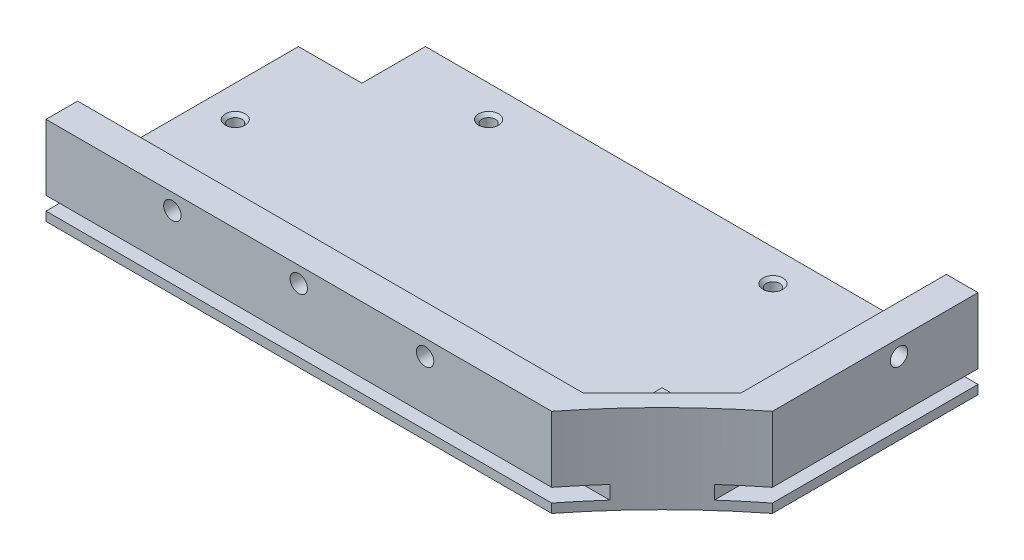
from build123d import *

# Parameters (mm, degrees)
SKETCH1_W                = 650
SKETCH1_H                = 650
BOSS_EXTRUDE1_DEPTH      = 8
BOSS_EXTRUDE2_DEPTH      = 650
CUT_EXTRUDE2_DEPTH       = 921.277302922
CUT_EXTRUDE2_DEPTH_BACK  = 921.277302922
SKETCH4_R                = 11
CUT_EXTRUDE1_DEPTH       = 920.932062709
CUT_EXTRUDE1_DEPTH_BACK  = 920.932062709
SKETCH2_R                = 210
CUT_EXTRUDE3_DEPTH       = 921.277302998
CUT_EXTRUDE3_DEPTH_BACK  = 110
CUT_EXTRUDE4_DEPTH       = 110
CUT_EXTRUDE5_DEPTH       = 920.932062713
CUT_EXTRUDE5_DEPTH_BACK  = 920.932062713
SKETCH7_OUTSIDE_W        = 836.056
SKETCH7_OUTSIDE_H        = 836.056
BOSS_EXTRUDE3_DEPTH      = 160.08
BOSS_EXTRUDE4_DEPTH      = 160.08
SKETCH21_W               = 10
SKETCH21_H               = 4.3
CUT_EXTRUDE10_DEPTH      = 680.197320372
SKETCH22_W               = 10
SKETCH22_H               = 4.3
CUT_EXTRUDE11_DEPTH      = 278.189465889
BOSS_EXTRUDE5_DEPTH      = 60
CUT_EXTRUDE6_DEPTH       = 679.914574891
CUT_EXTRUDE6_DEPTH_BACK  = 679.914574891
SKETCH12_R               = 210
CUT_EXTRUDE14_DEPTH      = 11
SKETCH27_R               = 2.2
SKETCH27_R_2             = 2.75
CUT_EXTRUDE15_DEPTH      = 11
SKETCH28_R               = 2.75
CUT_EXTRUDE16_DEPTH      = 11
SKETCH29_W               = 20
SKETCH29_H               = 20
CUT_EXTRUDE17_DEPTH      = 10
CUT_EXTRUDE18_DEPTH      = 679.914574891
CUT_EXTRUDE18_DEPTH_BACK = 679.914574891
SKETCH30_W               = 195
SKETCH30_H               = 95
CUT_EXTRUDE19_DEPTH      = 589.600033979
CUT_EXTRUDE19_DEPTH_BACK = 589.600033979
SKETCH31_W               = 20.1
SKETCH31_H               = 20.1
SKETCH32_R               = 2.15
CUT_EXTRUDE20_DEPTH      = 10
CHAMFER1_SIZE            = 1


with BuildPart() as part:
    # Sketch1 → Boss-Extrude1 (new body)
    with BuildSketch(Plane(origin=(0, 0, 0), x_dir=(1, 0, 0), z_dir=(0, 1, 0))):
        with Locations((325, 325)):
            Rectangle(SKETCH1_W, SKETCH1_H)
    extrude(amount=BOSS_EXTRUDE1_DEPTH)

    # Sketch3 → Boss-Extrude2 (add)
    with BuildSketch(Plane.XY):
        Polygon((300, 43.707142143), (350, 43.707142143), (385, 8), (265, 8), align=None)
    extrude(amount=-BOSS_EXTRUDE2_DEPTH)

    # Sketch4 → Cut-Extrude2 (cut, two sides: drawn at the far end of the back side and taken through both)
    with BuildSketch(Plane.XY.offset(-CUT_EXTRUDE2_DEPTH_BACK)):
        with Locations((325, 22)):
            Circle(SKETCH4_R)
    extrude(amount=CUT_EXTRUDE2_DEPTH + CUT_EXTRUDE2_DEPTH_BACK, mode=Mode.SUBTRACT)

    # Sketch2 → Cut-Extrude1 (cut, two sides: drawn at the far end of the back side and taken through both)
    with BuildSketch(Plane(origin=(0, 8, 0), x_dir=(1, 0, 0), z_dir=(0, 1, 0)).offset(-CUT_EXTRUDE1_DEPTH_BACK)):
        with Locations(Location((325, 325, 0), (0, 0, 270))):
            Circle(SKETCH2_R)
    extrude(amount=CUT_EXTRUDE1_DEPTH + CUT_EXTRUDE1_DEPTH_BACK, mode=Mode.SUBTRACT)

    # Sketch5 → Cut-Extrude3 (cut, two sides: drawn at the far end of the back side and taken through both)
    with BuildSketch(Plane.XY.offset(-CUT_EXTRUDE3_DEPTH_BACK)):
        Polygon((300, 43.707142143), (350, 43.707142143), (365.396078824, 28), (350, 28), (350, 8), (300, 8), (300, 28), (284.603921176, 28), align=None)
    extrude(amount=CUT_EXTRUDE3_DEPTH + CUT_EXTRUDE3_DEPTH_BACK, mode=Mode.SUBTRACT)

    # Sketch6 → Cut-Extrude4 (cut)
    with BuildSketch(Plane(origin=(0, 0, -650), x_dir=(-1, 0, 0), z_dir=(0, 0, -1))):
        Polygon((-350, 43.707142143), (-300, 43.707142143), (-284.603921176, 28), (-300, 28), (-300, 8), (-350, 8), (-350, 28), (-365.396078824, 28), align=None)
    extrude(amount=-CUT_EXTRUDE4_DEPTH, mode=Mode.SUBTRACT)

    # Sketch7 outside → Cut-Extrude5 (cut, two sides: drawn at the far end of the back side and taken through both)
    with BuildSketch(Plane(origin=(0, 8, 0), x_dir=(1, 0, 0), z_dir=(0, 1, 0)).offset(-CUT_EXTRUDE5_DEPTH_BACK)):
        with Locations((325, 325)):
            Rectangle(SKETCH7_OUTSIDE_W, SKETCH7_OUTSIDE_H)
        Polygon((195, 455), (195, 489.924225025), (195, 650), (167.478198198, 686.544504505), (-70.838918919, 686.544504505), (-70.838918919, 472.462112512), (0, 455), (160.075774975, 455), align=None, mode=Mode.SUBTRACT)
    extrude(amount=CUT_EXTRUDE5_DEPTH + CUT_EXTRUDE5_DEPTH_BACK, mode=Mode.SUBTRACT)

    # Sketch8 → Boss-Extrude3 (add)
    with BuildSketch(Plane(origin=(0, 0, -650), x_dir=(-1, 0, 0), z_dir=(0, 0, -1))):
        Polygon((-195, 8), (-195, 28), (-185, 28), (-185, 17), (-175, 8), align=None)
    extrude(amount=-BOSS_EXTRUDE3_DEPTH)

    # Sketch10 → Boss-Extrude4 (add)
    with BuildSketch(Plane.ZY):
        Polygon((-455, 8), (-455, 28), (-465, 28), (-465, 17), (-475, 8), align=None)
    extrude(amount=-BOSS_EXTRUDE4_DEPTH)

    # Sketch21 → Cut-Extrude10 (cut, through all)
    with BuildSketch(Plane.ZY):
        with Locations((-460, 5)):
            Rectangle(SKETCH21_W, SKETCH21_H)
    extrude(amount=-CUT_EXTRUDE10_DEPTH, mode=Mode.SUBTRACT)

    # Sketch22 → Cut-Extrude11 (cut, through all)
    with BuildSketch(Plane(origin=(0, 0, -650), x_dir=(-1, 0, 0), z_dir=(0, 0, -1))):
        with Locations((-190, 5)):
            Rectangle(SKETCH22_W, SKETCH22_H)
    extrude(amount=-CUT_EXTRUDE11_DEPTH, mode=Mode.SUBTRACT)

    # Sketch23 → Boss-Extrude5 (add)
    with BuildSketch(Plane.XY.offset(-489.92)):
        Polygon((194.99464011, 8), (195, 28), (160.08, 28), (160.08, 8), align=None)
    extrude(amount=BOSS_EXTRUDE5_DEPTH)

    # Sketch12 → Cut-Extrude6 (cut, two sides: drawn at the far end of the back side and taken through both)
    with BuildSketch(Plane(origin=(0, 8, 0), x_dir=(1, 0, 0), z_dir=(0, 1, 0)).offset(-CUT_EXTRUDE6_DEPTH_BACK)):
        with Locations((325, 325)):
            Circle(SKETCH12_R)
    extrude(amount=CUT_EXTRUDE6_DEPTH + CUT_EXTRUDE6_DEPTH_BACK, mode=Mode.SUBTRACT)

    # Sketch26 → Cut-Extrude14 (cut)
    with BuildSketch(Plane(origin=(0, 28, 0), x_dir=(1, 0, 0), z_dir=(0, 1, 0))):
        Polygon((185, 489.92), (160.08, 489.92), (160.08, 465), align=None)
    extrude(amount=-CUT_EXTRUDE14_DEPTH, mode=Mode.SUBTRACT)

    # Sketch27 → Cut-Extrude15 (cut)
    with BuildSketch(Plane.ZY.offset(-185)):
        with Locations((-610, 23)):
            Circle(SKETCH27_R)
        with Locations((-570, 23)):
            Circle(SKETCH27_R)
        with Locations((-530, 23)):
            Circle(SKETCH27_R_2)
    extrude(amount=-CUT_EXTRUDE15_DEPTH, mode=Mode.SUBTRACT)

    # Sketch28 → Cut-Extrude16 (cut)
    with BuildSketch(Plane(origin=(0, 0, -465), x_dir=(-1, 0, 0), z_dir=(0, 0, -1))):
        with Locations((-120, 23)):
            Circle(SKETCH28_R)
        with Locations((-80, 23)):
            Circle(SKETCH28_R)
        with Locations((-40, 23)):
            Circle(SKETCH28_R)
    extrude(amount=-CUT_EXTRUDE16_DEPTH, mode=Mode.SUBTRACT)

    # Sketch29 → Cut-Extrude17 (cut)
    with BuildSketch(Plane(origin=(0, 8, 0), x_dir=(1, 0, 0), z_dir=(0, 1, 0))):
        with Locations((10, 640)):
            Rectangle(SKETCH29_W, SKETCH29_H)
    extrude(amount=-CUT_EXTRUDE17_DEPTH, mode=Mode.SUBTRACT)

    # Sketch30 → Cut-Extrude18 (cut, two sides: drawn at the far end of the back side and taken through both)
    with BuildSketch(Plane(origin=(0, 8, 0), x_dir=(1, 0, 0), z_dir=(0, 1, 0)).offset(-CUT_EXTRUDE18_DEPTH_BACK)):
        with Locations((97.5, 602.5)):
            Rectangle(SKETCH30_W, SKETCH30_H)
    extrude(amount=CUT_EXTRUDE18_DEPTH + CUT_EXTRUDE18_DEPTH_BACK, mode=Mode.SUBTRACT)

    # Sketch31 → Cut-Extrude19 (cut, two sides: drawn at the far end of the back side and taken through both)
    with BuildSketch(Plane(origin=(0, 8, 0), x_dir=(1, 0, 0), z_dir=(0, 1, 0)).offset(-CUT_EXTRUDE19_DEPTH_BACK)):
        with Locations((10.05, 544.95)):
            Rectangle(SKETCH31_W, SKETCH31_H)
    extrude(amount=CUT_EXTRUDE19_DEPTH + CUT_EXTRUDE19_DEPTH_BACK, mode=Mode.SUBTRACT)

    # Sketch32 → Cut-Extrude20 (cut)
    with BuildSketch(Plane(origin=(0, 8, 0), x_dir=(1, 0, 0), z_dir=(0, 1, 0))):
        with Locations(Location((50.1, 545, 0), (0, 0, 270))):
            Circle(SKETCH32_R)
        with Locations(Location((140.1, 545, 0), (0, 0, 270))):
            Circle(SKETCH32_R)
        with Locations(Location((10, 504.9, 0), (0, 0, 270))):
            Circle(SKETCH32_R)
    extrude(amount=-CUT_EXTRUDE20_DEPTH, mode=Mode.SUBTRACT)

    # Chamfer1
    chamfer1_edges = [part.edges().sort_by_distance(p)[0] for p in [
        (10, 8, -507.05),
        (140.1, 8, -547.15),
        (50.1, 8, -547.15),
    ]]
    chamfer(chamfer1_edges, length=CHAMFER1_SIZE)


solid = part.part
